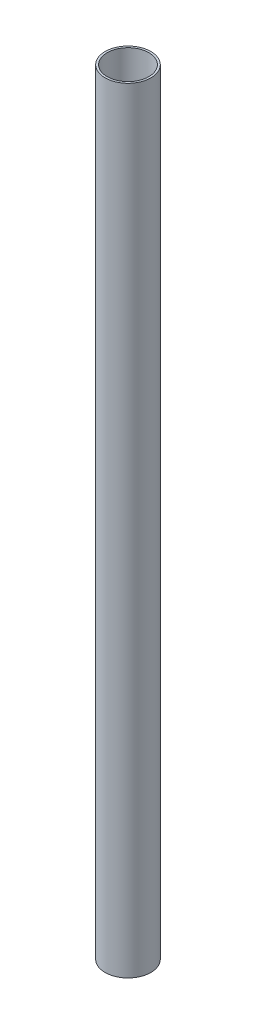
from build123d import *

# Parameters (mm, degrees)
SKETCH1_R           = 14.986
SKETCH1_R_2         = 13.6525
BOSS_EXTRUDE1_DEPTH = 508


with BuildPart() as part:
    # Sketch1 → Boss-Extrude1 (new body)
    with BuildSketch(Plane(origin=(0, 0, 0), x_dir=(1, 0, 0), z_dir=(0, 1, 0))):
        with Locations(Location((0, 0, 0), (0, 0, 270))):
            Circle(SKETCH1_R)
        with Locations(Location((0, 0, 0), (0, 0, 270))):
            Circle(SKETCH1_R_2, mode=Mode.SUBTRACT)
    extrude(amount=BOSS_EXTRUDE1_DEPTH)


solid = part.part
